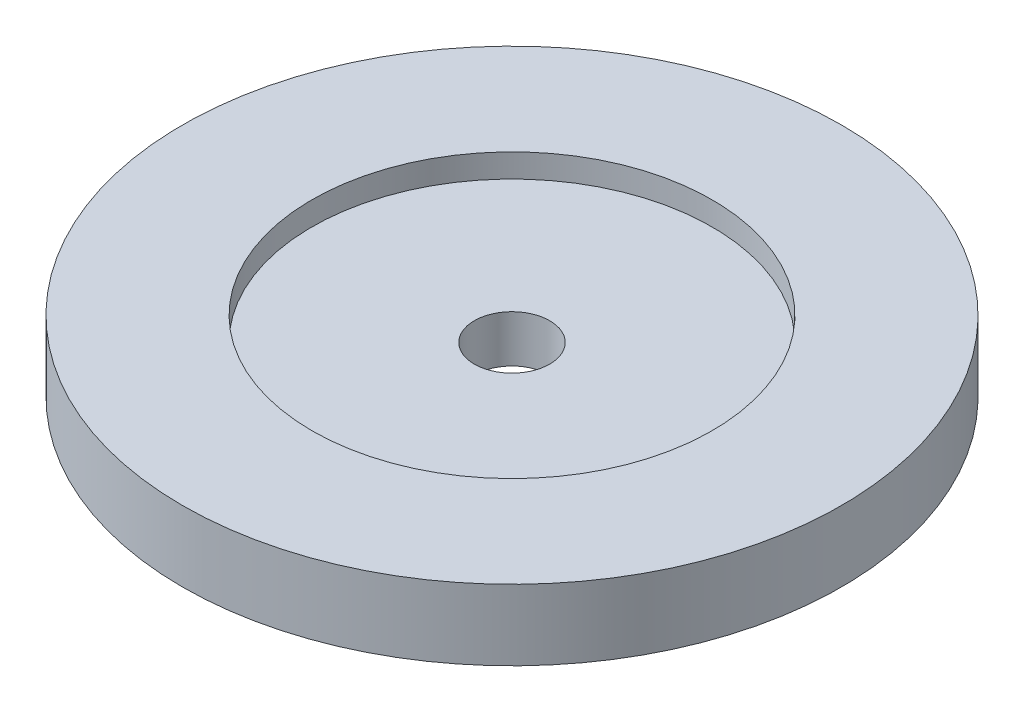
from build123d import *

# Parameters (mm, degrees)
SKETCH1_R           = 14
SKETCH1_R_2         = 1.6
BOSS_EXTRUDE1_DEPTH = 3
SKETCH2_R           = 8.5
CUT_EXTRUDE1_DEPTH  = 1


with BuildPart() as part:
    # Sketch1 → Boss-Extrude1 (new body)
    with BuildSketch(Plane(origin=(0, 0, 0), x_dir=(1, 0, 0), z_dir=(0, 1, 0))):
        with Locations(Location((0, 0, 0), (0, 0, 270))):
            Circle(SKETCH1_R)
        with Locations(Location((0, 0, 0), (0, 0, 270))):
            Circle(SKETCH1_R_2, mode=Mode.SUBTRACT)
    extrude(amount=BOSS_EXTRUDE1_DEPTH)

    # Sketch2 → Cut-Extrude1 (cut)
    with BuildSketch(Plane(origin=(0, 3, 0), x_dir=(1, 0, 0), z_dir=(0, 1, 0))):
        with Locations(Location((0, 0, 0), (0, 0, 270))):
            Circle(SKETCH2_R)
    extrude(amount=-CUT_EXTRUDE1_DEPTH, mode=Mode.SUBTRACT)


solid = part.part
